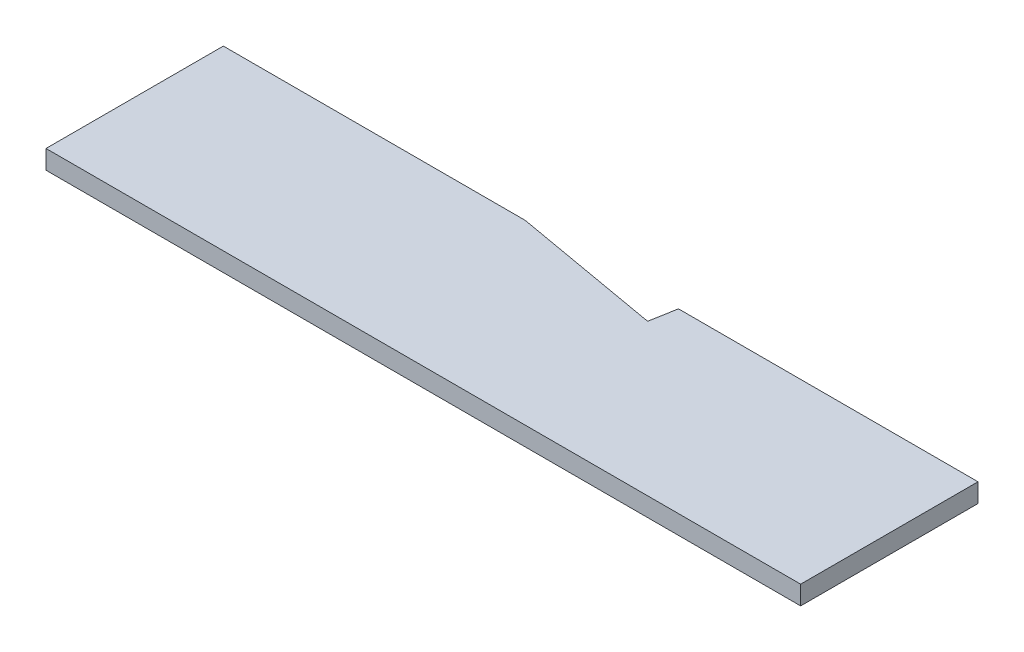
from build123d import *

# Parameters (mm, degrees)
BOSS_EXTRUDE1_DEPTH = 6.35


with BuildPart() as part:
    # Sketch1 → Boss-Extrude1 (new body)
    with BuildSketch(Plane(origin=(0, 0, 0), x_dir=(1, 0, 0), z_dir=(0, 1, 0))):
        Polygon((101.6, 59.69), (151.628233853, 50.868672575), (153.183671884, 59.69), (254, 59.69), (254, 0), (0, 0), (0, 59.69), align=None)
    extrude(amount=BOSS_EXTRUDE1_DEPTH)


solid = part.part
